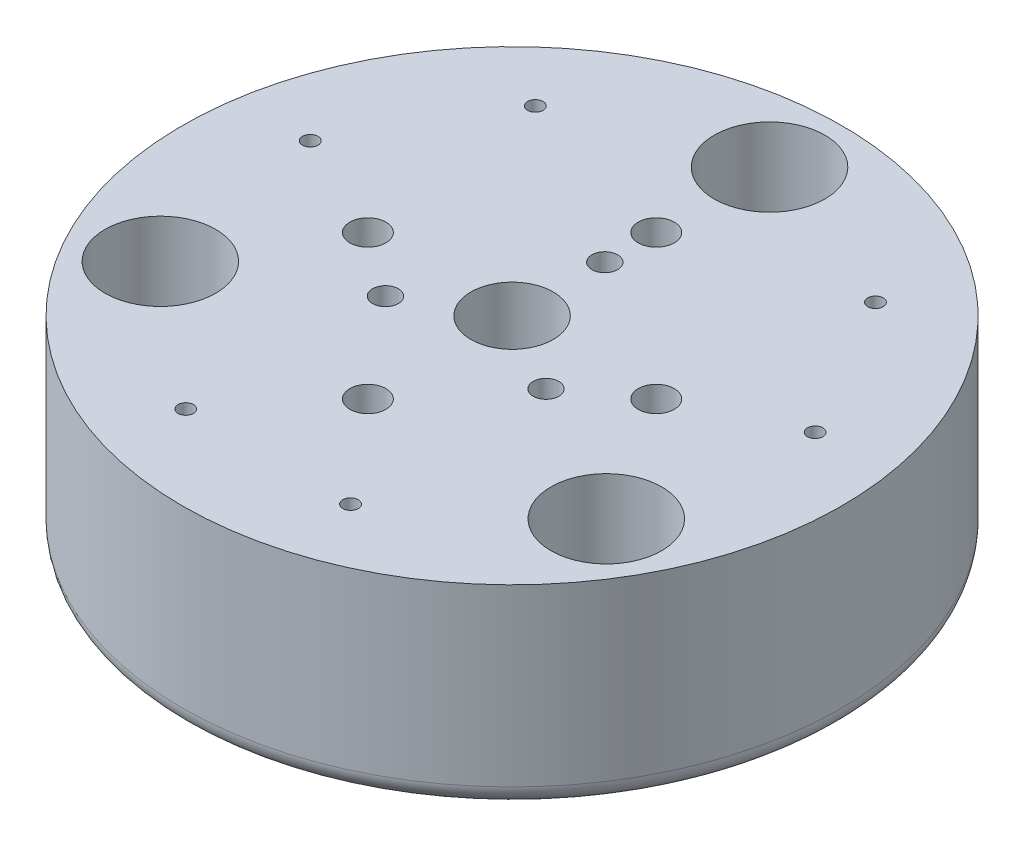
from build123d import *

# Parameters (mm, degrees)
SKETCH_1_R          = 32
SKETCH_1_R_2        = 4
SKETCH_1_R_3        = 3
EXTRUDE_1_DEPTH     = 19
FILLET_1_R          = 2
SKETCH_2_R          = 5.375
CUT_EXTRUDE_1_DEPTH = 15.5
SKETCH_3_R          = 2.625
CUT_EXTRUDE_2_DEPTH = 15
SKETCH_4_R          = 1.75
CUT_EXTRUDE_3_DEPTH = 50.081564832
SKETCH_5_R          = 1.25
CUT_EXTRUDE_4_DEPTH = 50.081564832
SKETCH_6_R          = 3
CUT_EXTRUDE_5_DEPTH = 8
SKETCH_7_R          = 1.95
CUT_EXTRUDE_6_DEPTH = 3
CHAMFER_1_SIZE      = 1
SKETCH_8_R          = 0.75
CUT_EXTRUDE_7_DEPTH = 50.081564832


with BuildPart() as part:
    # Эскиз1 → Бобышка-Вытянуть1 (new body)
    with BuildSketch(Plane(origin=(0, 0, 0), x_dir=(1, 0, 0), z_dir=(0, 1, 0))):
        with Locations(Location((0, 0, 0), (0, 0, 270))):
            Circle(SKETCH_1_R)
        with Locations(Location((0, 0, 0), (0, 0, 270))):
            Circle(SKETCH_1_R_2, mode=Mode.SUBTRACT)
        with Locations(Location((0, 25, 0), (0, 0, 270))):
            Circle(SKETCH_1_R_3, mode=Mode.SUBTRACT)
        with Locations(Location((21.650635095, -12.5, 0), (0, 0, 270))):
            Circle(SKETCH_1_R_3, mode=Mode.SUBTRACT)
        with Locations(Location((-21.650635095, -12.5, 0), (0, 0, 270))):
            Circle(SKETCH_1_R_3, mode=Mode.SUBTRACT)
    extrude(amount=EXTRUDE_1_DEPTH)

    # Скругление1
    fillet_1_edges = [part.edges().sort_by_distance(p)[0] for p in [
        (0, 0, -32),
    ]]
    fillet(fillet_1_edges, radius=FILLET_1_R)

    # Эскиз2 → Вырез-Вытянуть1 (cut)
    with BuildSketch(Plane(origin=(0, 19, 0), x_dir=(1, 0, 0), z_dir=(0, 1, 0))):
        with Locations(Location((0, 25, 0), (0, 0, 270))):
            Circle(SKETCH_2_R)
        with Locations(Location((21.650635095, -12.5, 0), (0, 0, 270))):
            Circle(SKETCH_2_R)
        with Locations(Location((-21.650635095, -12.5, 0), (0, 0, 270))):
            Circle(SKETCH_2_R)
    extrude(amount=-CUT_EXTRUDE_1_DEPTH, mode=Mode.SUBTRACT)

    # Эскиз3 → Вырез-Вытянуть2 (cut)
    with BuildSketch(Plane.XZ):
        with Locations(Location((0, 25, 0), (0, 0, 270))):
            Circle(SKETCH_3_R)
        with Locations(Location((21.650635095, -12.5, 0), (0, 0, 270))):
            Circle(SKETCH_3_R)
        with Locations(Location((-21.650635095, -12.5, 0), (0, 0, 270))):
            Circle(SKETCH_3_R)
    extrude(amount=-CUT_EXTRUDE_2_DEPTH, mode=Mode.SUBTRACT)

    # Эскиз4 → Вырез-Вытянуть3 (cut, through all)
    with BuildSketch(Plane.XZ):
        with Locations(Location((0, 14, 0), (0, 0, 270))):
            Circle(SKETCH_4_R)
        with Locations(Location((14, 0, 0), (0, 0, 270))):
            Circle(SKETCH_4_R)
        with Locations(Location((0, -14, 0), (0, 0, 270))):
            Circle(SKETCH_4_R)
        with Locations(Location((-14, 0, 0), (0, 0, 270))):
            Circle(SKETCH_4_R)
    extrude(amount=-CUT_EXTRUDE_3_DEPTH, mode=Mode.SUBTRACT)

    # Эскиз5 → Вырез-Вытянуть4 (cut, through all)
    with BuildSketch(Plane(origin=(0, 19, 0), x_dir=(1, 0, 0), z_dir=(0, 1, 0))):
        with Locations(Location((0, 9, 0), (0, 0, 270))):
            Circle(SKETCH_5_R)
        with Locations(Location((7.794228634, -4.5, 0), (0, 0, 270))):
            Circle(SKETCH_5_R)
        with Locations(Location((-7.794228634, -4.5, 0), (0, 0, 270))):
            Circle(SKETCH_5_R)
    extrude(amount=-CUT_EXTRUDE_4_DEPTH, mode=Mode.SUBTRACT)

    # Эскиз6 → Вырез-Вытянуть5 (cut)
    with BuildSketch(Plane.XZ):
        with Locations(Location((0, 14, 0), (0, 0, 270))):
            Circle(SKETCH_6_R)
        with Locations(Location((14, 0, 0), (0, 0, 270))):
            Circle(SKETCH_6_R)
        with Locations(Location((0, -14, 0), (0, 0, 270))):
            Circle(SKETCH_6_R)
        with Locations(Location((-14, 0, 0), (0, 0, 270))):
            Circle(SKETCH_6_R)
    extrude(amount=-CUT_EXTRUDE_5_DEPTH, mode=Mode.SUBTRACT)

    # Эскиз7 → Вырез-Вытянуть6 (cut)
    with BuildSketch(Plane.XZ):
        with Locations(Location((7.794228634, 4.5, 0), (0, 0, 270))):
            Circle(SKETCH_7_R)
        with Locations(Location((0, -9, 0), (0, 0, 270))):
            Circle(SKETCH_7_R)
        with Locations(Location((-7.794228634, 4.5, 0), (0, 0, 270))):
            Circle(SKETCH_7_R)
    extrude(amount=-CUT_EXTRUDE_6_DEPTH, mode=Mode.SUBTRACT)

    # Фаска1
    chamfer_1_edges = [part.edges().sort_by_distance(p)[0] for p in [
        (21.650635095, 0, 9.5),
        (-21.650635095, 0, 9.5),
        (0, 0, 27.625),
        (21.650635095, 0, -9.875),
        (-21.650635095, 0, -9.875),
        (0, 0, -4),
        (0, 0, -28),
    ]]
    chamfer(chamfer_1_edges, length=CHAMFER_1_SIZE)

    # Эскиз8 → Вырез-Вытянуть7 (cut, through all)
    with BuildSketch(Plane.XZ):
        with Locations(Location((-8, 23.685438565, 0), (0, 0, 270))):
            Circle(SKETCH_8_R)
        with Locations(Location((8, 23.685438565, 0), (0, 0, 270))):
            Circle(SKETCH_8_R)
        with Locations(Location((24.512191497, -4.914516052, 0), (0, 0, 270))):
            Circle(SKETCH_8_R)
        with Locations(Location((16.512191497, -18.770922513, 0), (0, 0, 270))):
            Circle(SKETCH_8_R)
        with Locations(Location((-16.512191497, -18.770922513, 0), (0, 0, 270))):
            Circle(SKETCH_8_R)
        with Locations(Location((-24.512191497, -4.914516052, 0), (0, 0, 270))):
            Circle(SKETCH_8_R)
    extrude(amount=-CUT_EXTRUDE_7_DEPTH, mode=Mode.SUBTRACT)


solid = part.part
